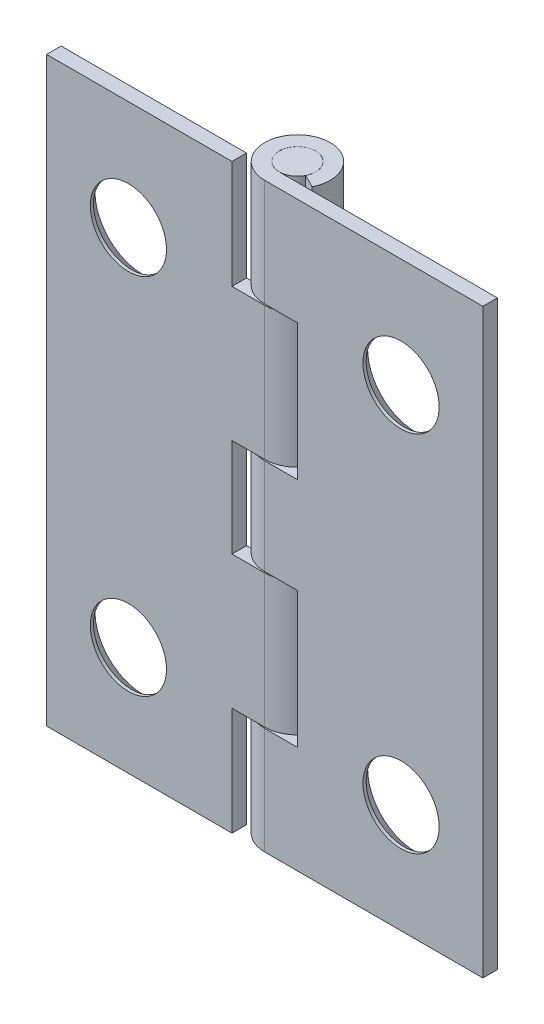
from build123d import *

# Parameters (mm, degrees)
EXTRUDE1_DEPTH          = 12.7
LPATTERN2_COUNT         = 2
LPATTERN2_PITCH         = 15.875
CUT_EXTRUDE1_DEPTH      = 16.93916408
CUT_EXTRUDE1_DEPTH_BACK = 16.93916408
SKETCH4_W               = 2.8575
SKETCH4_H               = 5.9309
CUT_EXTRUDE2_DEPTH      = 16.93916408
CUT_EXTRUDE2_DEPTH_BACK = 16.93916408
SKETCH5_W               = 2.8575
SKETCH5_H               = 4.7244
SKETCH5_H_2             = 4.2926
EXTRUDE2_START          = -12.7
SKETCH6_R               = 0.79121
EXTRUDE2_DEPTH          = 25.4


with BuildPart() as part:
    # Sketch1 → Extrude1 (new, symmetric)
    with BuildSketch(Plane(origin=(0, 0, 0), x_dir=(1, 0, 0), z_dir=(0, 1, 0))):
        with BuildLine():
            Line((0, -0.79375), (9.525, -0.79375))
            Line((9.525, -0.79375), (9.525, -1.42875))
            Line((9.525, -1.42875), (0, -1.42875))
            ThreePointArc((0, -1.42875), (-0.753017368, 1.214204022), (1.279883418, -0.635))
            Line((1.279883418, -0.635), (0.711046343, -0.352777778))
            ThreePointArc((0.711046343, -0.352777778), (-0.418342982, 0.67455779), (0, -0.79375))
        make_face()
    extrude(amount=EXTRUDE1_DEPTH, both=True)

    # Sketch7 → Cut-Revolve1 (revolve, cut)
    with BuildSketch(Plane(origin=(5.953125, 0, 0), x_dir=(0, 0, -1), z_dir=(1, 0, 0)), mode=Mode.PRIVATE) as cut_revolve1_sk:
        Polygon((-0.79375, 7.9375), (-0.79375, 10.033), (-1.290479078, 9.6012), (-1.42875, 9.6012), (-1.42875, 7.9375), align=None)
    cut_revolve1 = revolve(cut_revolve1_sk.sketch.rotate(Axis((5.953125, 7.9375, -1.822321443), (0, 0, 1)), 90), axis=Axis((5.953125, 7.9375, -1.822321443), (0, 0, 1)), mode=Mode.SUBTRACT)

    # LPattern2: Cut-Revolve1 ×2
    with Locations(*[(0, -i * LPATTERN2_PITCH, 0) for i in range(1, LPATTERN2_COUNT)]):
        add(cut_revolve1, mode=Mode.SUBTRACT)


with BuildPart() as body_2:
    # Mirror2: mirrored copy
    add(part.part.mirror(Plane(origin=(0, 0, 0), x_dir=(0, 0, 1), z_dir=(1, 0, 0))))

    # Sketch5 → Cut-Extrude2 (cut, two sides: drawn at the far end of the back side and taken through both)
    with BuildSketch(Plane.XY.offset(-CUT_EXTRUDE2_DEPTH_BACK)):
        with Locations((0, -10.3378)):
            Rectangle(SKETCH5_W, SKETCH5_H)
        Rectangle(SKETCH5_W, SKETCH5_H_2)
        with Locations((0, 10.3378)):
            Rectangle(SKETCH5_W, SKETCH5_H)
    extrude(amount=CUT_EXTRUDE2_DEPTH + CUT_EXTRUDE2_DEPTH_BACK, mode=Mode.SUBTRACT)


with BuildPart() as part_1:
    add(part.part)

    # Sketch4 → Cut-Extrude1 (cut, two sides: drawn at the far end of the back side and taken through both)
    with BuildSketch(Plane.XY.offset(-CUT_EXTRUDE1_DEPTH_BACK)):
        with Locations((0, 5.06095)):
            Rectangle(SKETCH4_W, SKETCH4_H)
        with Locations((0, -5.06095)):
            Rectangle(SKETCH4_W, SKETCH4_H)
    extrude(amount=CUT_EXTRUDE1_DEPTH + CUT_EXTRUDE1_DEPTH_BACK, mode=Mode.SUBTRACT)


with BuildPart() as body_3:
    # Sketch6 → Extrude2 (new body)
    with BuildSketch(Plane(origin=(0, 0, 0), x_dir=(1, 0, 0), z_dir=(0, 1, 0)).offset(EXTRUDE2_START)):
        with Locations(Location((0, 0, 0), (0, 0, 270))):
            Circle(SKETCH6_R)
    extrude(amount=EXTRUDE2_DEPTH)


solid = Compound([body_2.part, part_1.part, body_3.part])
